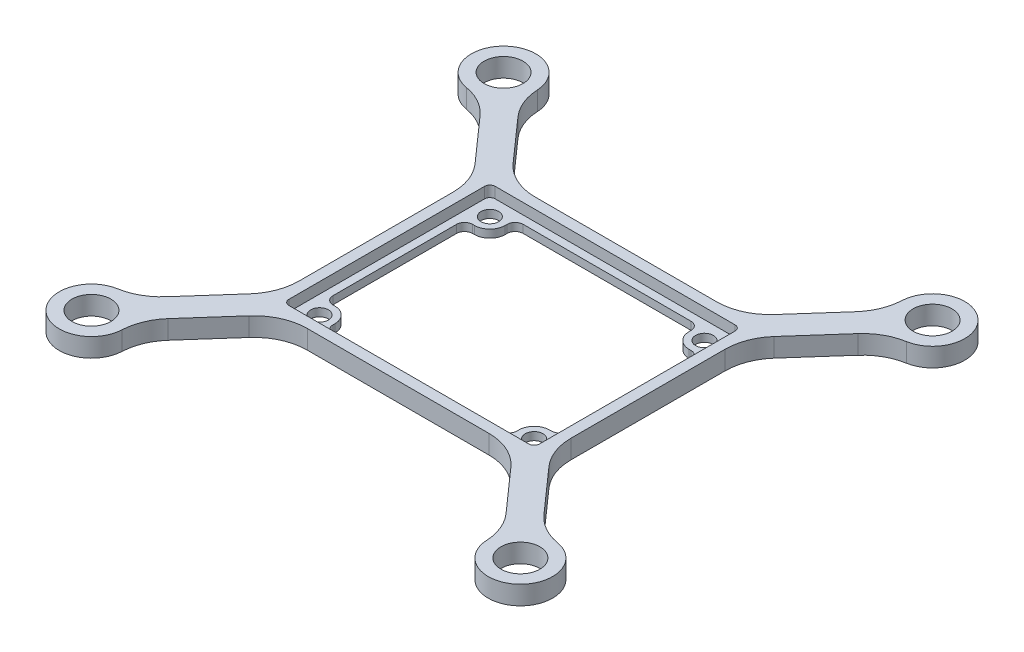
from build123d import *

# Parameters (mm, degrees)
SKETCH1_W                 = 50.705
SKETCH1_H                 = 42.455
SKETCH1_R                 = 1.65288
BOSS_EXTRUDE1_DEPTH       = 3.5
SKETCH2_W                 = 46.705
SKETCH2_H                 = 38.455
CUT_EXTRUDE1_DEPTH        = 2.024
SKETCH3_R                 = 6
SKETCH3_R_2               = 3.625
BOSS_EXTRUDE2_DEPTH       = 3.5
FILLET2_R                 = 1.5
FILLET3_R                 = 1
MIRROR2_COPY_1_SKETCH_R   = 6
MIRROR2_COPY_1_SKETCH_R_2 = 3.625
MIRROR2_COPY_1_DEPTH      = 3.5
FILLET1_R                 = 10


with BuildPart() as part:
    # Sketch1 → Boss-Extrude1 (new body)
    with BuildSketch(Plane(origin=(0, 0, 0), x_dir=(1, 0, 0), z_dir=(0, 1, 0))):
        Rectangle(SKETCH1_W, SKETCH1_H)
        with Locations(Location((-19.995, 15.87, 0), (0, 0, 270))):
            Circle(SKETCH1_R, mode=Mode.SUBTRACT)
        with Locations(Location((19.995, 15.87, 0), (0, 0, 90))):
            Circle(SKETCH1_R, mode=Mode.SUBTRACT)
        with Locations(Location((19.995, -15.87, 0), (0, 0, 270))):
            Circle(SKETCH1_R, mode=Mode.SUBTRACT)
        with Locations(Location((-19.995, -15.87, 0), (0, 0, 90))):
            Circle(SKETCH1_R, mode=Mode.SUBTRACT)
        with BuildLine():
            Line((21.8525, 13.0125), (21.8525, -13.0125))
            Line((21.8525, -13.0125), (19.995, -13.0125))
            ThreePointArc((19.995, -13.0125), (17.974442373, -13.849442373), (17.1375, -15.87))
            Line((17.1375, -15.87), (17.1375, -17.7275))
            Line((17.1375, -17.7275), (-17.1375, -17.7275))
            Line((-17.1375, -17.7275), (-17.1375, -15.87))
            ThreePointArc((-17.1375, -15.87), (-17.974442373, -13.849442373), (-19.995, -13.0125))
            Line((-19.995, -13.0125), (-21.8525, -13.0125))
            Line((-21.8525, -13.0125), (-21.8525, 13.0125))
            Line((-21.8525, 13.0125), (-19.995, 13.0125))
            ThreePointArc((-19.995, 13.0125), (-17.974442373, 13.849442373), (-17.1375, 15.87))
            Line((-17.1375, 15.87), (-17.1375, 17.7275))
            Line((-17.1375, 17.7275), (17.1375, 17.7275))
            Line((17.1375, 17.7275), (17.1375, 15.87))
            ThreePointArc((17.1375, 15.87), (17.974442373, 13.849442373), (19.995, 13.0125))
            Line((19.995, 13.0125), (21.8525, 13.0125))
        make_face(mode=Mode.SUBTRACT)
    extrude(amount=BOSS_EXTRUDE1_DEPTH)

    # Sketch2 → Cut-Extrude1 (cut)
    with BuildSketch(Plane(origin=(0, 3.5, 0), x_dir=(1, 0, 0), z_dir=(0, 1, 0))):
        Rectangle(SKETCH2_W, SKETCH2_H)
    extrude(amount=-CUT_EXTRUDE1_DEPTH, mode=Mode.SUBTRACT)

    # Sketch3 → Boss-Extrude2 (add)
    # profile 1 of 3: a face of its own
    with BuildSketch(Plane(origin=(0, 3.5, 0), x_dir=(1, 0, 0), z_dir=(0, 1, 0))):
        with BuildLine():
            Line((-25.3525, 21.2275), (-21.403966459, 21.2275))
            Line((-21.403966459, 21.2275), (-34.48647943, 35.98289392))
            ThreePointArc((-34.48647943, 35.98289392), (-35.995113658, 33.91607267), (-38.227727219, 32.665807098))
            Line((-38.227727219, 32.665807098), (-25.3525, 18.144204877))
            Line((-25.3525, 18.144204877), (-25.3525, 21.2275))
        make_face()
    # profile 2 of 3: a face of its own
    with BuildSketch(Plane(origin=(0, 3.5, 0), x_dir=(1, 0, 0), z_dir=(0, 1, 0))):
        Polygon((-23.891843474, 20.265138811), (-20.550712197, 20.265138811), (-21.403966459, 21.2275), (-25.3525, 21.2275), (-25.3525, 18.144204877), (-24.536212364, 17.223537292), align=None)
    # profile 3 of 3: a face of its own
    with BuildSketch(Plane(origin=(0, 3.5, 0), x_dir=(1, 0, 0), z_dir=(0, 1, 0))):
        with Locations((-39.975617845, 38.405570016)):
            Circle(SKETCH3_R)
        with Locations(Location((-39.975617845, 38.405570016, 0), (0, 0, 270))):
            Circle(SKETCH3_R_2, mode=Mode.SUBTRACT)
    boss_extrude2 = extrude(amount=-BOSS_EXTRUDE2_DEPTH)

    # Fillet2
    fillet2_edges = [part.edges().sort_by_distance(p)[0] for p in [
        (21.8525, 0.738, -13.0125),
        (21.8525, 0.738, 13.0125),
        (17.1375, 0.738, 17.7275),
        (-17.1375, 0.738, 17.7275),
        (-21.8525, 0.738, 13.0125),
        (-21.8525, 0.738, -13.0125),
        (-17.1375, 0.738, -17.7275),
        (17.1375, 0.738, -17.7275),
    ]]
    fillet(fillet2_edges, radius=FILLET2_R)

    # Fillet3
    fillet3_edges = [part.edges().sort_by_distance(p)[0] for p in [
        (-23.3525, 2.488, 19.2275),
        (-23.3525, 2.488, -19.2275),
        (23.3525, 2.488, -19.2275),
        (23.3525, 2.488, 19.2275),
    ]]
    fillet(fillet3_edges, radius=FILLET3_R)

    # Mirror1: Boss-Extrude2 across plane
    add(boss_extrude2.mirror(Plane.XY))

    # Mirror2: Boss-Extrude2 across plane
    add(boss_extrude2.mirror(Plane(origin=(0, 0, 0), x_dir=(0, 0, 1), z_dir=(1, 0, 0))))

    # Mirror2 copy 1 sketch → Mirror2 copy 1 (add)
    # profile 1 of 3: a face of its own
    with BuildSketch(Plane(origin=(0, 3.5, 0), x_dir=(-1, 0, 0), z_dir=(0, 1, 0))):
        with BuildLine():
            Line((-25.3525, 21.2275), (-21.403966459, 21.2275))
            Line((-21.403966459, 21.2275), (-34.48647943, 35.98289392))
            ThreePointArc((-34.48647943, 35.98289392), (-35.995113658, 33.91607267), (-38.227727219, 32.665807098))
            Line((-38.227727219, 32.665807098), (-25.3525, 18.144204877))
            Line((-25.3525, 18.144204877), (-25.3525, 21.2275))
        make_face()
    # profile 2 of 3: a face of its own
    with BuildSketch(Plane(origin=(0, 3.5, 0), x_dir=(-1, 0, 0), z_dir=(0, 1, 0))):
        Polygon((-23.891843474, 20.265138811), (-20.550712197, 20.265138811), (-21.403966459, 21.2275), (-25.3525, 21.2275), (-25.3525, 18.144204877), (-24.536212364, 17.223537292), align=None)
    # profile 3 of 3: a face of its own
    with BuildSketch(Plane(origin=(0, 3.5, 0), x_dir=(-1, 0, 0), z_dir=(0, 1, 0))):
        with Locations((-39.975617845, 38.405570016)):
            Circle(MIRROR2_COPY_1_SKETCH_R)
        with Locations(Location((-39.975617845, 38.405570016, 0), (0, 0, 270))):
            Circle(MIRROR2_COPY_1_SKETCH_R_2, mode=Mode.SUBTRACT)
    extrude(amount=-MIRROR2_COPY_1_DEPTH)

    # Fillet1
    fillet1_edges = [part.edges().sort_by_distance(p)[0] for p in [
        (-25.3525, 1.75, -18.144204877),
        (-21.403966459, 1.75, -21.2275),
        (-34.48647943, 1.75, -35.98289392),
        (-38.227727219, 1.75, -32.665807098),
        (-21.403966459, 1.75, 21.2275),
        (-38.227727219, 1.75, 32.665807098),
        (-34.48647943, 1.75, 35.98289392),
        (-25.3525, 1.75, 18.144204877),
        (25.3525, 1.75, 18.144204877),
        (34.48647943, 1.75, 35.98289392),
        (38.227727219, 1.75, 32.665807098),
        (21.403966459, 1.75, 21.2275),
        (21.403966459, 1.75, -21.2275),
        (38.227727219, 1.75, -32.665807098),
        (34.48647943, 1.75, -35.98289392),
        (25.3525, 1.75, -18.144204877),
    ]]
    fillet(fillet1_edges, radius=FILLET1_R)


solid = part.part
